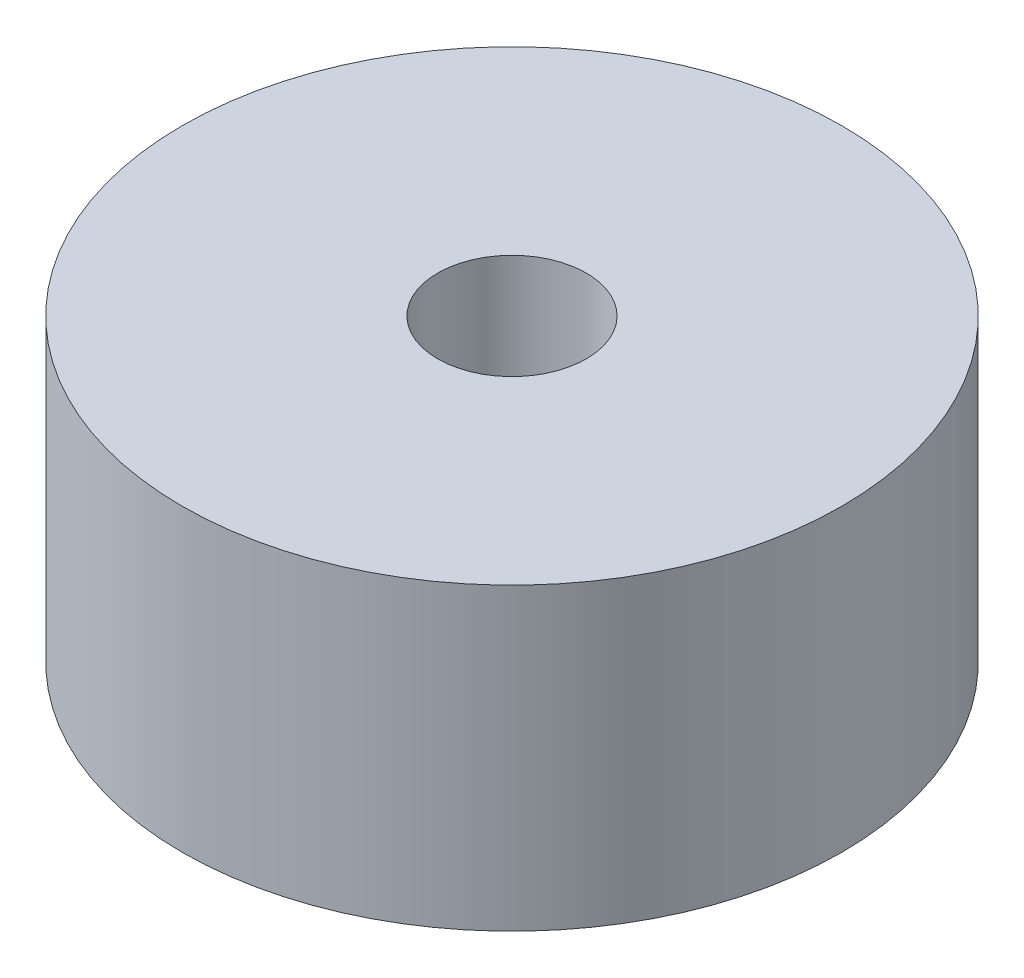
from build123d import *

# Parameters (mm, degrees)
SKETCH1_R           = 5.5
SKETCH1_R_2         = 1.24
BOSS_EXTRUDE1_DEPTH = 5


with BuildPart() as part:
    # Sketch1 → Boss-Extrude1 (new body)
    with BuildSketch(Plane(origin=(0, 0, 0), x_dir=(1, 0, 0), z_dir=(0, 1, 0))):
        with Locations(Location((0, 0, 0), (0, 0, 270))):
            Circle(SKETCH1_R)
        with Locations(Location((0, 0, 0), (0, 0, 270))):
            Circle(SKETCH1_R_2, mode=Mode.SUBTRACT)
    extrude(amount=BOSS_EXTRUDE1_DEPTH)


solid = part.part
